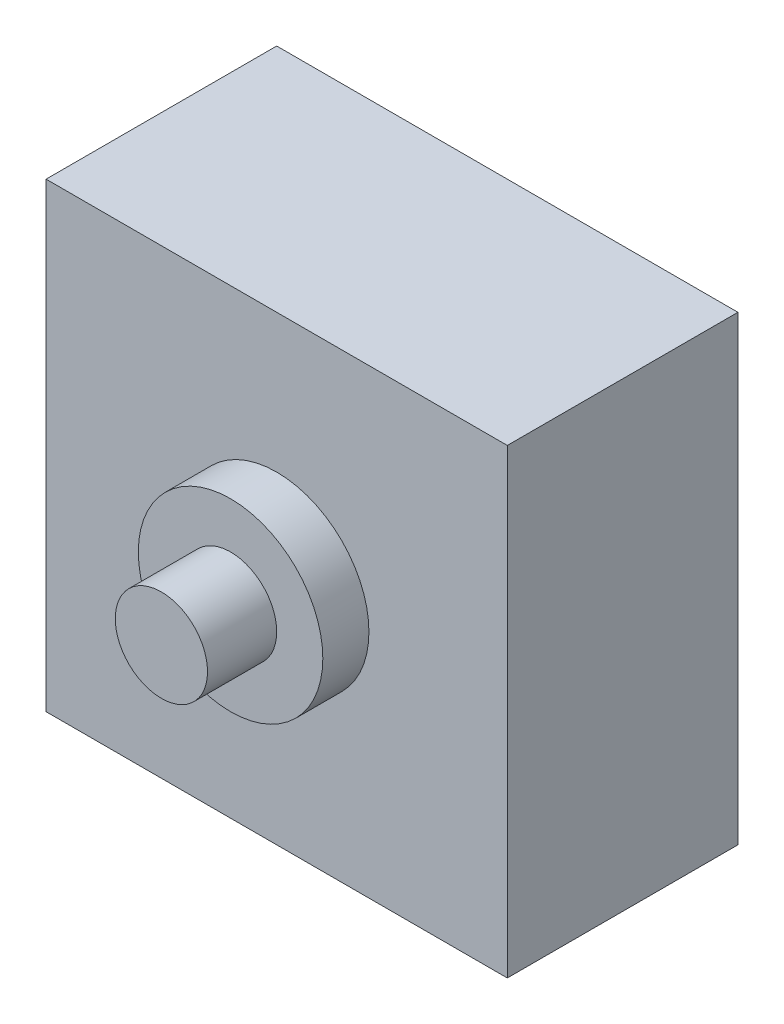
from build123d import *

# Parameters (mm, degrees)
SKETCH1_W           = 200
SKETCH1_H           = 200
BOSS_EXTRUDE1_DEPTH = 100
SKETCH2_R           = 40
BOSS_EXTRUDE2_DEPTH = 20
SKETCH3_R           = 20
BOSS_EXTRUDE3_DEPTH = 30


with BuildPart() as part:
    # Sketch1 → Boss-Extrude1 (new body)
    with BuildSketch(Plane.XY):
        Rectangle(SKETCH1_W, SKETCH1_H)
    extrude(amount=BOSS_EXTRUDE1_DEPTH)

    # Sketch2 → Boss-Extrude2 (add)
    with BuildSketch(Plane.XY.offset(100)):
        Circle(SKETCH2_R)
    extrude(amount=BOSS_EXTRUDE2_DEPTH)

    # Sketch3 → Boss-Extrude3 (add)
    with BuildSketch(Plane.XY.offset(120)):
        Circle(SKETCH3_R)
    extrude(amount=BOSS_EXTRUDE3_DEPTH)


solid = part.part
